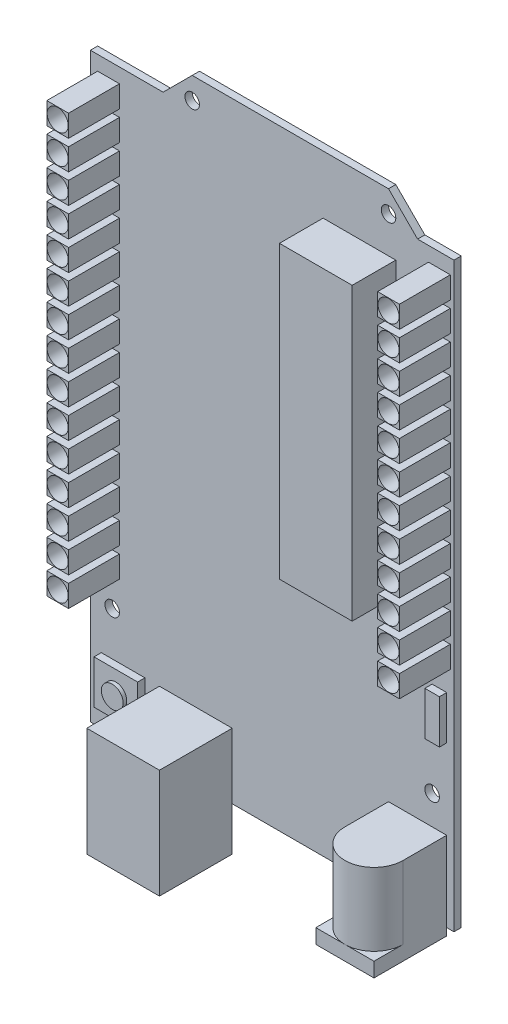
from build123d import *

# Parameters (mm, degrees)
SKETCH1_W            = 50
SKETCH1_H            = 80
BOSS_EXTRUDE1_DEPTH  = 1
SKETCH2_R            = 1
CUT_EXTRUDE1_DEPTH   = 1
SKETCH3_W            = 3
SKETCH3_H            = 3
SKETCH3_R            = 1.45
BOSS_EXTRUDE2_DEPTH  = 7
LPATTERN1_COUNT      = 12
LPATTERN1_PITCH      = 4
SKETCH4_W            = 2
SKETCH4_H            = 6
BOSS_EXTRUDE3_DEPTH  = 1
SKETCH5_W            = 10
SKETCH5_H            = 40
BOSS_EXTRUDE4_DEPTH  = 6
SKETCH6_W            = 3
SKETCH6_H            = 3
SKETCH6_R            = 1.45
BOSS_EXTRUDE5_DEPTH  = 7
LPATTERN3_COUNT      = 15
LPATTERN3_PITCH      = 4
SKETCH7_W            = 6
SKETCH7_H            = 6
BOSS_EXTRUDE6_DEPTH  = 1
SKETCH8_R            = 1.5
BOSS_EXTRUDE7_DEPTH  = 0.5
SKETCH9_W            = 10
SKETCH9_H            = 15
BOSS_EXTRUDE8_DEPTH  = 10
SKETCH10_W           = 3.997593526
SKETCH10_H           = 2
CUT_EXTRUDE2_DEPTH   = 10
SKETCH11_W           = 8
SKETCH11_H           = 2
BOSS_EXTRUDE9_DEPTH  = 10
BOSS_EXTRUDE10_DEPTH = 10
SKETCH13_R           = 3
SKETCH13_R_2         = 0.5
CUT_EXTRUDE3_DEPTH   = 10


with BuildPart() as part:
    # Sketch1 → Boss-Extrude1 (new body)
    with BuildSketch(Plane.XY):
        Polygon((-15, 40), (20, 40), (16, 44), (-11, 44), align=None)
        Rectangle(SKETCH1_W, SKETCH1_H)
    extrude(amount=BOSS_EXTRUDE1_DEPTH)

    # Sketch2 → Cut-Extrude1 (cut)
    with BuildSketch(Plane.XY.offset(1)):
        with Locations((-11, 41)):
            Circle(SKETCH2_R)
        with Locations((16, 41)):
            Circle(SKETCH2_R)
        with Locations((-22, -25)):
            Circle(SKETCH2_R)
        with Locations((22, -25)):
            Circle(SKETCH2_R)
    extrude(amount=-CUT_EXTRUDE1_DEPTH, mode=Mode.SUBTRACT)

    # Sketch3 → Boss-Extrude2 (add)
    with BuildSketch(Plane.XY.offset(1)):
        with Locations((23, 36.5)):
            Rectangle(SKETCH3_W, SKETCH3_H)
        with Locations((23, 36.5)):
            Circle(SKETCH3_R, mode=Mode.SUBTRACT)
    boss_extrude2 = extrude(amount=BOSS_EXTRUDE2_DEPTH)

    # LPattern1: Boss-Extrude2 ×12
    with Locations(*[(0, -i * LPATTERN1_PITCH, 0) for i in range(1, LPATTERN1_COUNT)]):
        add(boss_extrude2)

    # Sketch4 → Boss-Extrude3 (add)
    with BuildSketch(Plane.XY.offset(1)):
        with Locations((23, -15)):
            Rectangle(SKETCH4_W, SKETCH4_H)
    extrude(amount=BOSS_EXTRUDE3_DEPTH)

    # Sketch5 → Boss-Extrude4 (add)
    with BuildSketch(Plane.XY.offset(1)):
        with Locations((12, 16)):
            Rectangle(SKETCH5_W, SKETCH5_H)
    extrude(amount=BOSS_EXTRUDE4_DEPTH)

    # Sketch6 → Boss-Extrude5 (add)
    with BuildSketch(Plane.XY.offset(1)):
        with Locations((-22.5, 36.5)):
            Rectangle(SKETCH6_W, SKETCH6_H)
        with Locations((-22.5, 36.5)):
            Circle(SKETCH6_R, mode=Mode.SUBTRACT)
    boss_extrude5 = extrude(amount=BOSS_EXTRUDE5_DEPTH)

    # LPattern3: Boss-Extrude5 ×15
    with Locations(*[(0, -i * LPATTERN3_PITCH, 0) for i in range(1, LPATTERN3_COUNT)]):
        add(boss_extrude5)

    # Sketch7 → Boss-Extrude6 (add)
    with BuildSketch(Plane.XY.offset(1)):
        with Locations((-20.5, -34)):
            Rectangle(SKETCH7_W, SKETCH7_H)
    extrude(amount=BOSS_EXTRUDE6_DEPTH)

    # Sketch8 → Boss-Extrude7 (add)
    with BuildSketch(Plane.XY.offset(2)):
        with Locations((-20.5, -34)):
            Circle(SKETCH8_R)
    extrude(amount=BOSS_EXTRUDE7_DEPTH)

    # Sketch9 → Boss-Extrude8 (add)
    with BuildSketch(Plane.XY.offset(1)):
        with Locations((-10.5, -38.5)):
            Rectangle(SKETCH9_W, SKETCH9_H)
    extrude(amount=BOSS_EXTRUDE8_DEPTH)

    # Sketch10 → Cut-Extrude2 (cut)
    with BuildSketch(Plane.XZ.offset(46)):
        Polygon((-12.75, 9.75), (-14.75, 7.75), (-14.75, 1.75), (-6.25, 1.75), (-6.25, 7.75), (-8.25, 9.75), align=None)
        with Locations((-10.5, 4.75)):
            Rectangle(SKETCH10_W, SKETCH10_H, mode=Mode.SUBTRACT)
    extrude(amount=-CUT_EXTRUDE2_DEPTH, mode=Mode.SUBTRACT)

    # Sketch11 → Boss-Extrude9 (add)
    with BuildSketch(Plane.XY.offset(1)):
        with Locations((20, -40)):
            Rectangle(SKETCH11_W, SKETCH11_H)
    extrude(amount=BOSS_EXTRUDE9_DEPTH)

    # Sketch12 → Boss-Extrude10 (add)
    with BuildSketch(Plane(origin=(0, -39, 0), x_dir=(1, 0, 0), z_dir=(0, 1, 0))):
        with BuildLine():
            Line((16, -1), (24, -1))
            Line((24, -1), (24, -7))
            ThreePointArc((24, -7), (20, -11), (16, -7))
            Line((16, -7), (16, -1))
        make_face()
    extrude(amount=BOSS_EXTRUDE10_DEPTH)

    # Sketch13 → Cut-Extrude3 (cut)
    with BuildSketch(Plane.XZ.offset(41)):
        with Locations(Location((20, 7, 0), (0, 0, 270))):
            Circle(SKETCH13_R)
        with Locations(Location((20, 7, 0), (0, 0, 270))):
            Circle(SKETCH13_R_2, mode=Mode.SUBTRACT)
    extrude(amount=-CUT_EXTRUDE3_DEPTH, mode=Mode.SUBTRACT)


solid = part.part
